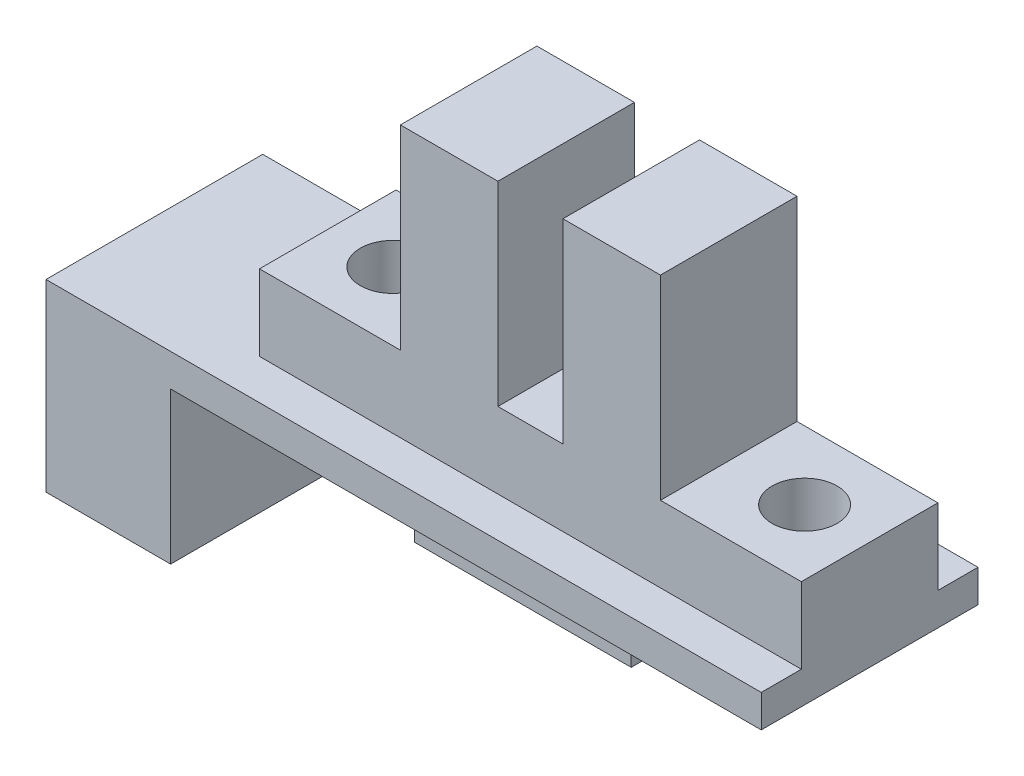
from build123d import *

# Parameters (mm, degrees)
SKETCH_1_W               = 33
SKETCH_1_H               = 10
EXTRUDE_1_DEPTH          = 1.5
SKETCH_2_W               = 5.75
SKETCH_2_H               = 10
EXTRUDE_2_DEPTH          = 7
CUT_EXTRUDE_1_DEPTH      = 20.222382787
CUT_EXTRUDE_1_DEPTH_BACK = 20.222382787
SKETCH_3_R               = 1.5
EXTRUDE_START            = 3.5
SKETCH_4_W               = 25
SKETCH_4_H               = 6.3
SKETCH_4_R               = 1.5
EXTRUDE_3_DEPTH          = 3.5
SKETCH_5_W               = 4.5
SKETCH_5_H               = 6.3
EXTRUDE_4_DEPTH          = 9
SKETCH_6_W               = 10
SKETCH_6_H               = 7
EXTRUDE_5_DEPTH          = 2


with BuildPart() as part:
    # Эскиз1 → Бобышка-Вытянуть1 (new body)
    with BuildSketch(Plane(origin=(0, 0, 0), x_dir=(1, 0, 0), z_dir=(0, 1, 0))):
        Rectangle(SKETCH_1_W, SKETCH_1_H)
    extrude(amount=EXTRUDE_1_DEPTH)

    # Эскиз2 → Бобышка-Вытянуть2 (add)
    with BuildSketch(Plane.XZ):
        with Locations((-13.625, 0)):
            Rectangle(SKETCH_2_W, SKETCH_2_H)
    extrude(amount=EXTRUDE_2_DEPTH)

    # Эскиз3 → Вырез-Вытянуть1 (cut, two sides: drawn at the far end of the back side and taken through both)
    with BuildSketch(Plane(origin=(0, 1.5, 0), x_dir=(1, 0, 0), z_dir=(0, 1, 0)).offset(-CUT_EXTRUDE_1_DEPTH_BACK)):
        with Locations(Location((13.5, 0, 0), (0, 0, 90))):
            Circle(SKETCH_3_R)
        with Locations(Location((-5.5, 0, 0), (0, 0, 90))):
            Circle(SKETCH_3_R)
    extrude(amount=CUT_EXTRUDE_1_DEPTH + CUT_EXTRUDE_1_DEPTH_BACK, mode=Mode.SUBTRACT)

    # Эскиз4 → Бобышка-Вытянуть3 (add)
    with BuildSketch(Plane(origin=(0, 1.5, 0), x_dir=(1, 0, 0), z_dir=(0, 1, 0)).offset(EXTRUDE_START)):
        with Locations((4, 0)):
            Rectangle(SKETCH_4_W, SKETCH_4_H)
        with Locations(Location((13.5, 0, 0), (0, 0, 270))):
            Circle(SKETCH_4_R, mode=Mode.SUBTRACT)
        with Locations(Location((-5.5, 0, 0), (0, 0, 270))):
            Circle(SKETCH_4_R, mode=Mode.SUBTRACT)
    extrude(amount=-EXTRUDE_3_DEPTH)

    # Эскиз5 → Бобышка-Вытянуть4 (add)
    with BuildSketch(Plane(origin=(0, 5, 0), x_dir=(1, 0, 0), z_dir=(0, 1, 0))):
        with Locations((7.75, 0)):
            Rectangle(SKETCH_5_W, SKETCH_5_H)
        with Locations((0.25, 0)):
            Rectangle(SKETCH_5_W, SKETCH_5_H)
    extrude(amount=EXTRUDE_4_DEPTH)

    # Эскиз6 → Бобышка-Вытянуть5 (add)
    with BuildSketch(Plane.XZ):
        with Locations((4, 0)):
            Rectangle(SKETCH_6_W, SKETCH_6_H)
    extrude(amount=EXTRUDE_5_DEPTH)


solid = part.part
